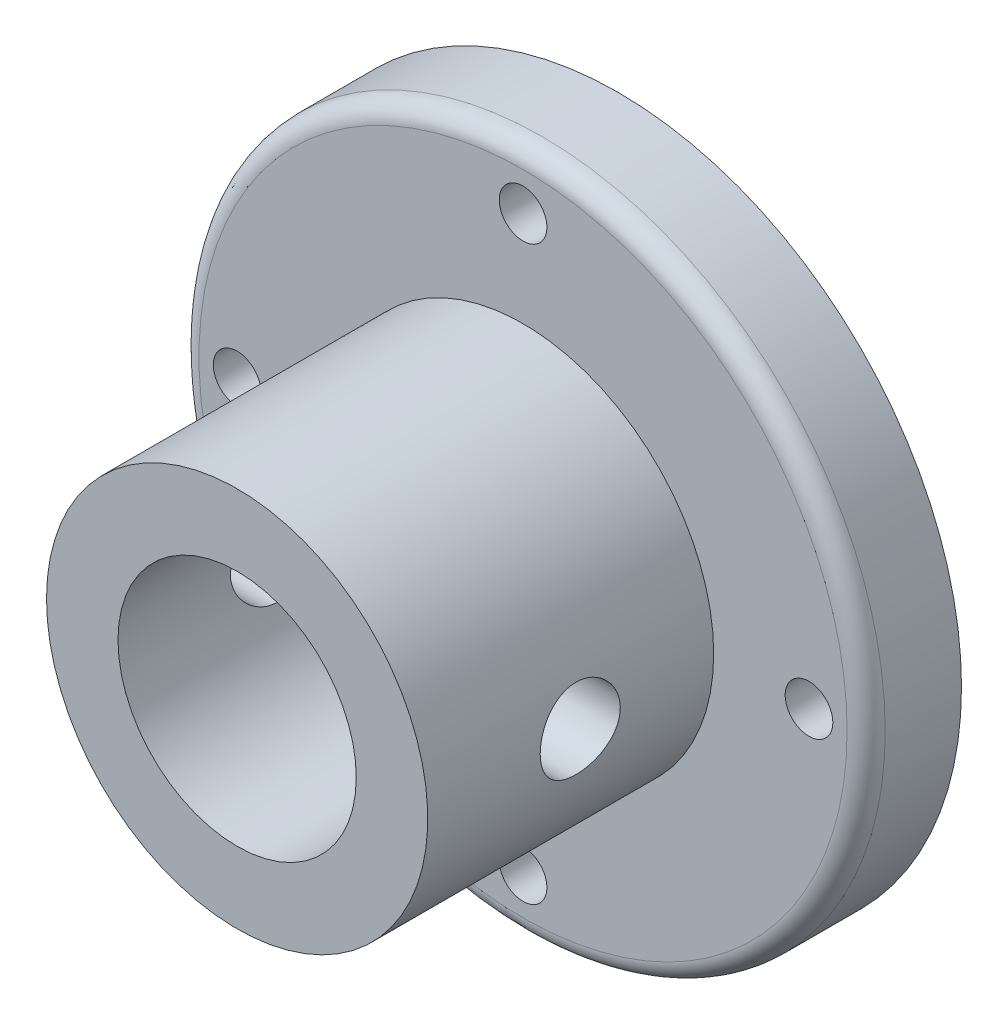
from build123d import *

# Parameters (mm, degrees)
SKETCH_1_R               = 18
SKETCH_1_R_2             = 12
SKETCH_1_R_3             = 1.25
EXTRUDE_1_DEPTH          = 5
EXTRUDE_START            = -2
SKETCH_2_R               = 12
SKETCH_2_R_2             = 10
EXTRUDE_2_DEPTH          = 2
FILLET_1_R               = 1
SKETCH_3_R               = 10
SKETCH_3_R_2             = 6.25
EXTRUDE_3_DEPTH          = 17
CUT_EXTRUDE_1_DEPTH      = 20
CUT_EXTRUDE_1_DEPTH_BACK = 20
SKETCH_4_R               = 2.1


with BuildPart() as part:
    # 草图1 → 凸台-拉伸1 (new body)
    with BuildSketch(Plane.XY):
        Circle(SKETCH_1_R)
        Circle(SKETCH_1_R_2, mode=Mode.SUBTRACT)
        with Locations((0, 15)):
            Circle(SKETCH_1_R_3, mode=Mode.SUBTRACT)
        with Locations((-15, 0)):
            Circle(SKETCH_1_R_3, mode=Mode.SUBTRACT)
        with Locations((0, -15)):
            Circle(SKETCH_1_R_3, mode=Mode.SUBTRACT)
        with Locations((15, 0)):
            Circle(SKETCH_1_R_3, mode=Mode.SUBTRACT)
    extrude(amount=EXTRUDE_1_DEPTH)

    # 草图2 → 凸台-拉伸2 (add)
    with BuildSketch(Plane.XY.offset(5).offset(EXTRUDE_START)):
        Circle(SKETCH_2_R)
        Circle(SKETCH_2_R_2, mode=Mode.SUBTRACT)
    extrude(amount=EXTRUDE_2_DEPTH)

    # 圆角1
    fillet_1_edges = [part.edges().sort_by_distance(p)[0] for p in [
        (-18, 0, 5),
    ]]
    fillet(fillet_1_edges, radius=FILLET_1_R)

    # 草图3 → 凸台-拉伸3 (add)
    with BuildSketch(Plane(origin=(0, 0, 3), x_dir=(-1, 0, 0), z_dir=(0, 0, -1))):
        Circle(SKETCH_3_R)
        Circle(SKETCH_3_R_2, mode=Mode.SUBTRACT)
    extrude(amount=-EXTRUDE_3_DEPTH)

    # 草图4 → 切除-拉伸1 (cut, two sides: drawn at the far end of the back side and taken through both)
    with BuildSketch(Plane(origin=(0, 0, 0), x_dir=(0, 0, -1), z_dir=(1, 0, 0)).offset(-CUT_EXTRUDE_1_DEPTH_BACK)):
        with Locations((-12, 0)):
            Circle(SKETCH_4_R)
    extrude(amount=CUT_EXTRUDE_1_DEPTH + CUT_EXTRUDE_1_DEPTH_BACK, mode=Mode.SUBTRACT)


solid = part.part
